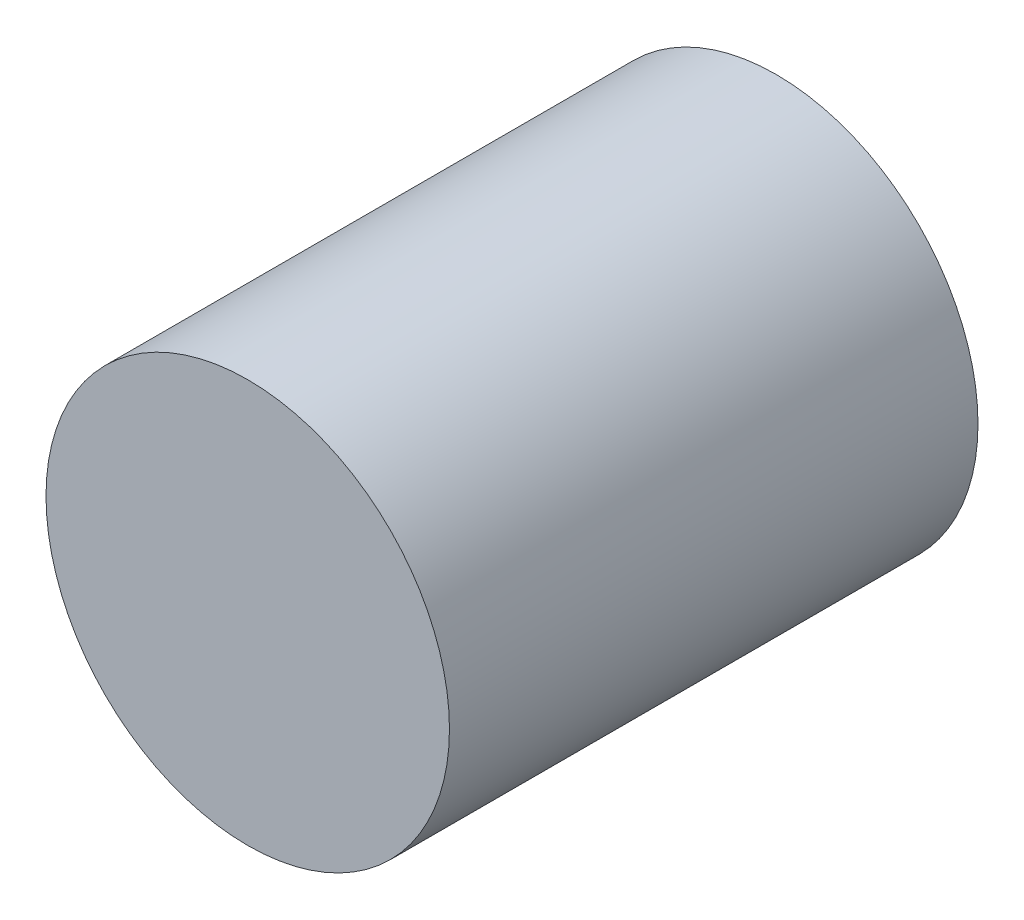
from build123d import *

# Parameters (mm, degrees)
SKETCH_1_R      = 10
SKETCH_1_R_2    = 8
EXTRUDE_1_DEPTH = 24.2
SKETCH_2_R      = 10
EXTRUDE_2_DEPTH = 2
SKETCH_3_R      = 3
EXTRUDE_3_DEPTH = 24.2


with BuildPart() as part:
    # 草图1 → 凸台-拉伸1 (new body)
    with BuildSketch(Plane.XY):
        Circle(SKETCH_1_R)
        Circle(SKETCH_1_R_2, mode=Mode.SUBTRACT)
    extrude(amount=EXTRUDE_1_DEPTH)

    # 草图2 → 凸台-拉伸2 (add)
    with BuildSketch(Plane.XY.offset(24.2)):
        Circle(SKETCH_2_R)
    extrude(amount=EXTRUDE_2_DEPTH)

    # 草图3 → 凸台-拉伸3 (add)
    with BuildSketch(Plane(origin=(0, 0, 24.2), x_dir=(-1, 0, 0), z_dir=(0, 0, -1))):
        with Locations(Location((0, 0, 0), (0, 0, 180))):
            Circle(SKETCH_3_R)
    extrude(amount=EXTRUDE_3_DEPTH)


solid = part.part
